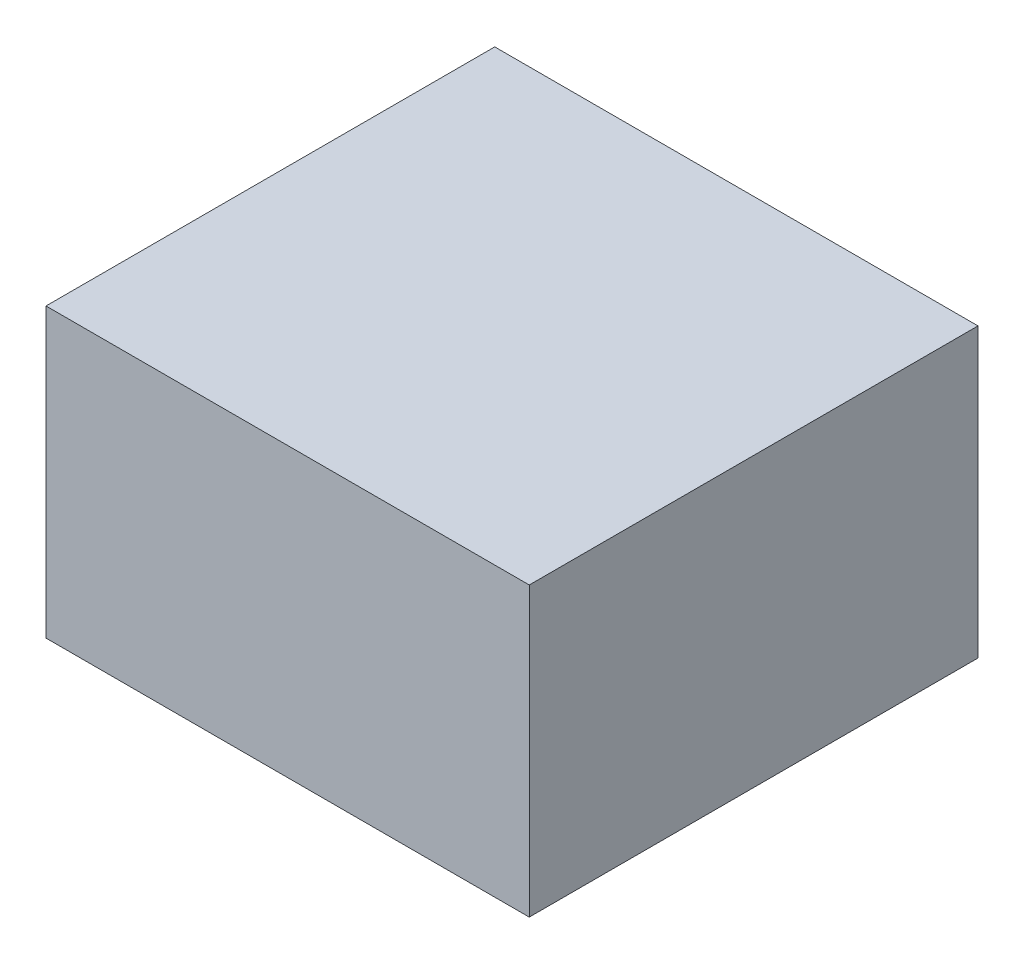
from build123d import *

# Parameters (mm, degrees)
ESQUISSE1_W             = 42
ESQUISSE1_H             = 25
BOSS_EXTRU_1_DEPTH      = 39
ESQUISSE2_W             = 10
ESQUISSE2_H             = 3
ENL_V_MAT_EXTRU_1_DEPTH = 10
ESQUISSE3_W             = 4
ESQUISSE3_H             = 3
ENL_V_MAT_EXTRU_2_DEPTH = 10


with BuildPart() as part:
    # Esquisse1 → Boss.-Extru.1 (new body)
    with BuildSketch(Plane.XY):
        Rectangle(ESQUISSE1_W, ESQUISSE1_H)
    extrude(amount=BOSS_EXTRU_1_DEPTH)

    # Esquisse2 → Enlèv. mat.-Extru.1 (cut)
    with BuildSketch(Plane(origin=(0, 0, 0), x_dir=(-1, 0, 0), z_dir=(0, 0, -1))):
        with Locations((11, -0.28777271)):
            Rectangle(ESQUISSE2_W, ESQUISSE2_H)
    extrude(amount=-ENL_V_MAT_EXTRU_1_DEPTH, mode=Mode.SUBTRACT)

    # Esquisse3 → Enlèv. mat.-Extru.2 (cut)
    with BuildSketch(Plane(origin=(-16, 0, 0), x_dir=(0, 0, -1), z_dir=(1, 0, 0))):
        with Locations((-8, -0.28777271)):
            Rectangle(ESQUISSE3_W, ESQUISSE3_H)
    extrude(amount=-ENL_V_MAT_EXTRU_2_DEPTH, mode=Mode.SUBTRACT)


solid = part.part
